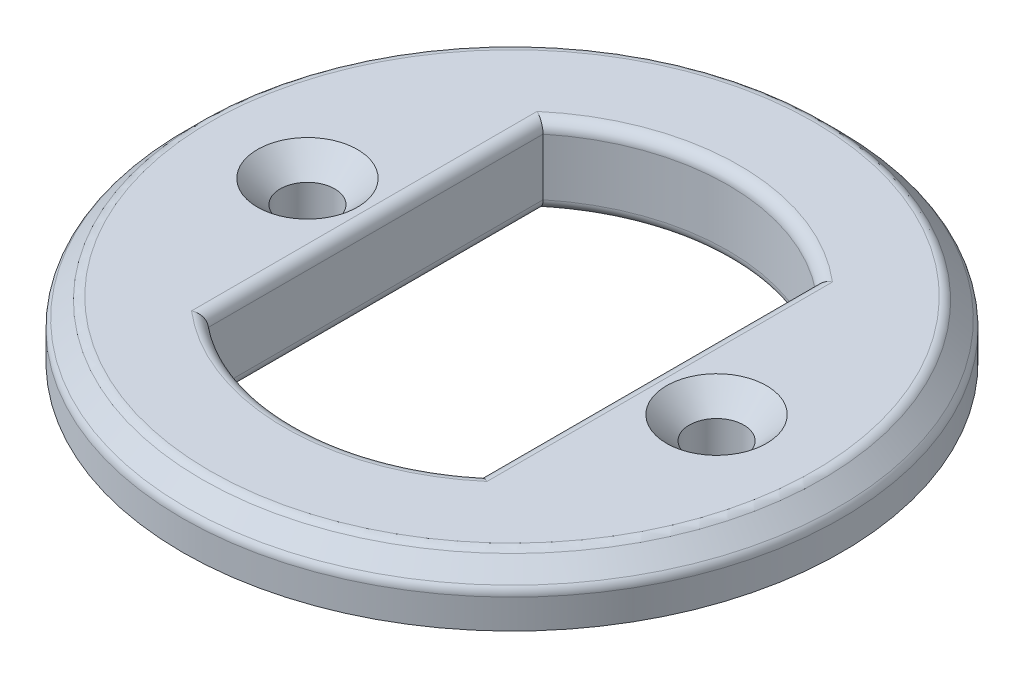
from build123d import *

# Parameters (mm, degrees)
ENL_V_MAT_EXTRU_1_DEPTH                        = 21.802644063
CONG_1_R                                       = 0.5
FRAISAGE_POUR_VIS_T_TE_FRAIS_E_M21_D           = 2.4
FRAISAGE_POUR_VIS_T_TE_FRAIS_E_M21_CSINK_D     = 4.4
FRAISAGE_POUR_VIS_T_TE_FRAIS_E_M21_CSINK_ANGLE = 90


with BuildPart() as part:
    # Esquisse1 → Révolution1 (revolve)
    with BuildSketch(Plane.XY, mode=Mode.PRIVATE) as r_volution1_sk:
        Polygon((12, 0), (12, 1), (14.5, 1), (14.5, 2.5), (13.5, 3.5), (0, 3.5), (0, 0), align=None)
    revolve(r_volution1_sk.sketch.rotate(Axis((0, -5.347368421, 0), (0, 1, 0)), 90), axis=Axis((0, -5.347368421, 0), (0, 1, 0)))

    # Esquisse2 → Enlèv. mat.-Extru.1 (cut, through all)
    with BuildSketch(Plane(origin=(0, 3.5, 0), x_dir=(1, 0, 0), z_dir=(0, 1, 0))):
        with BuildLine():
            Line((-6, -7.365459931), (-6, 7.365459931))
            ThreePointArc((-6, 7.365459931), (0, 9.5), (6, 7.365459931))
            Line((6, 7.365459931), (6, -7.365459931))
            ThreePointArc((6, -7.365459931), (0, -9.5), (-6, -7.365459931))
        make_face()
    extrude(amount=-ENL_V_MAT_EXTRU_1_DEPTH, mode=Mode.SUBTRACT)

    # Congé1
    cong_1_edges = [part.edges().sort_by_distance(p)[0] for p in [
        (0, 0, 9.5),
        (-6, 0, 0),
        (0, 0, -9.5),
        (6, 0, 0),
        (0, 3.5, 9.5),
        (6, 3.5, 0),
        (0, 3.5, -9.5),
        (-6, 3.5, 0),
        (0, 2.5, 14.5),
        (0, 3.5, 13.5),
    ]]
    fillet(cong_1_edges, radius=CONG_1_R)

    # Fraisage pour vis à tête fraisée M21 (through all)
    with Locations(Plane(origin=(-9, 3.5, 0), x_dir=(0, 0, 1), z_dir=(0, 1, 0))):
        with Locations((0, 0), (0, 18)):
            CounterSinkHole(FRAISAGE_POUR_VIS_T_TE_FRAIS_E_M21_D / 2, FRAISAGE_POUR_VIS_T_TE_FRAIS_E_M21_CSINK_D / 2, counter_sink_angle=FRAISAGE_POUR_VIS_T_TE_FRAIS_E_M21_CSINK_ANGLE)


solid = part.part
